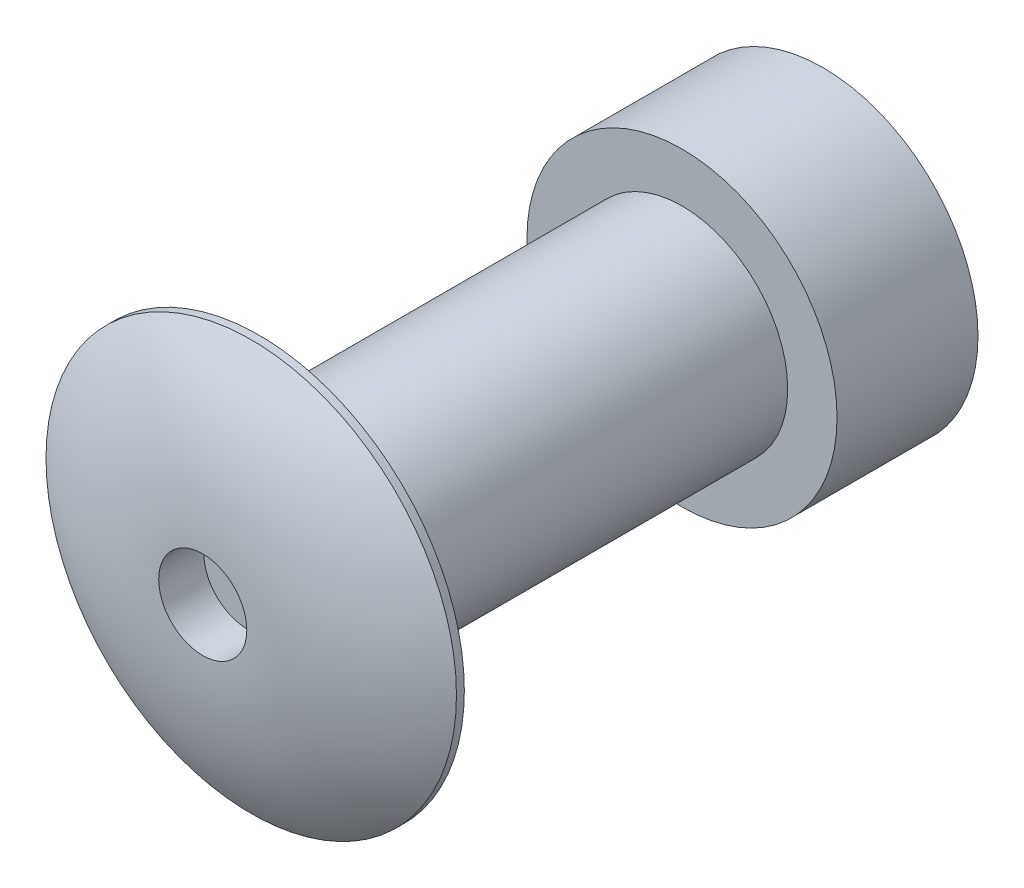
from build123d import *

# Parameters (mm, degrees)
SKETCH4_R          = 0.9921875
CUT_EXTRUDE1_DEPTH = 1.016
CUT_EXTRUDE2_START = -2.54
SKETCH3_R          = 0.9921875
CUT_EXTRUDE2_DEPTH = 2.54


with BuildPart() as part:
    # Sketch2 → Revolve1 (revolve)
    with BuildSketch(Plane(origin=(0, 0, 0), x_dir=(0, 0, -1), z_dir=(1, 0, 0)), mode=Mode.PRIVATE) as revolve1_sk:
        with BuildLine():
            Line((-1.27, 0.9921875), (-1.27, 0))
            Line((-1.27, 0), (9.525, 0))
            Line((9.525, 0), (12.7, 0))
            Line((12.7, 0), (12.7, 3.4925))
            Line((12.7, 3.4925), (9.525, 3.4925))
            Line((9.525, 3.4925), (9.525, 2.38125))
            Line((9.525, 2.38125), (0, 2.38125))
            Line((0, 2.38125), (0, 4.6228))
            Line((0, 4.6228), (-0.1778, 4.6228))
            ThreePointArc((-0.1778, 4.6228), (-0.991036966, 2.887856773), (-1.27, 0.9921875))
        make_face()
    revolve(revolve1_sk.sketch.rotate(Axis((0, 0, 7.600580616), (0, 0, 1)), 90), axis=Axis((0, 0, 7.600580616), (0, 0, 1)))

    # Sketch4 → Cut-Extrude1 (cut)
    with BuildSketch(Plane.XY.offset(1.27)):
        Circle(SKETCH4_R)
    extrude(amount=-CUT_EXTRUDE1_DEPTH, mode=Mode.SUBTRACT)

    # Sketch3 → Cut-Extrude2 (cut)
    with BuildSketch(Plane(origin=(0, 0, -12.7), x_dir=(-1, 0, 0), z_dir=(0, 0, -1)).offset(CUT_EXTRUDE2_START)):
        with Locations(Location((0, 0, 0), (0, 0, 180))):
            Circle(SKETCH3_R)
    extrude(amount=CUT_EXTRUDE2_DEPTH, mode=Mode.SUBTRACT)


solid = part.part
